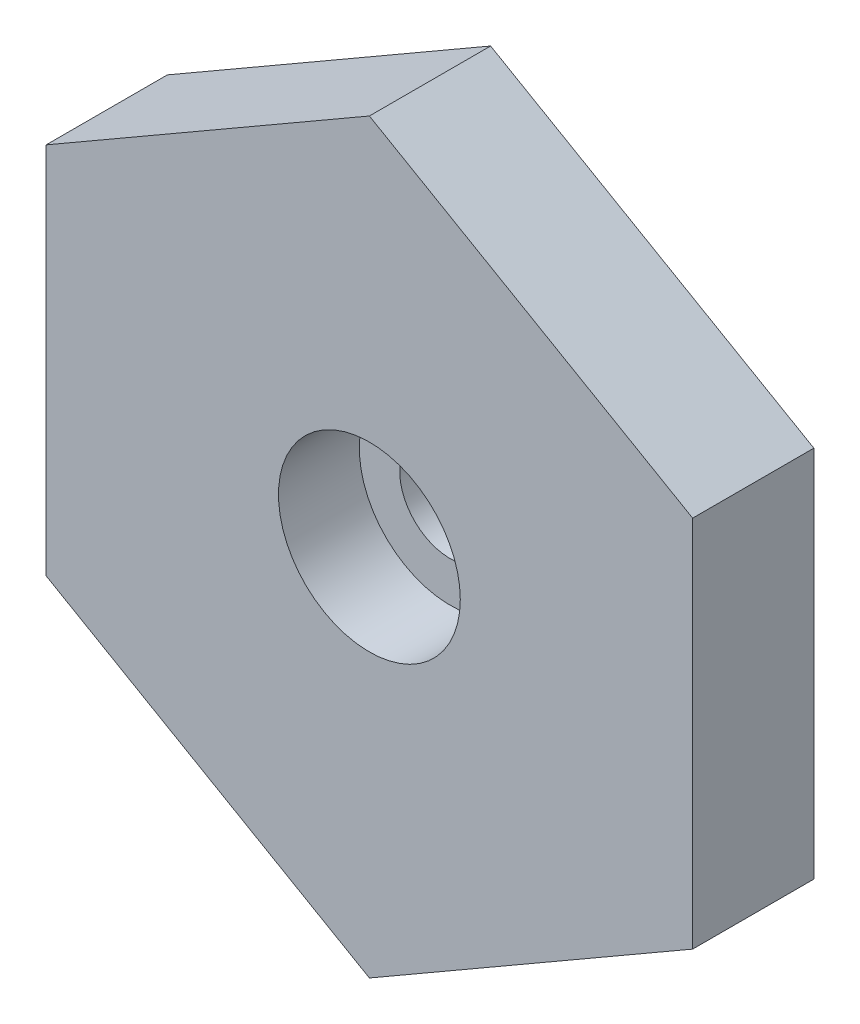
from build123d import *

# Parameters (mm, degrees)
SKIZZE1_R                       = 2.5
AUFSATZ_LINEAR_AUSTRAGEN1_DEPTH = 6
SKIZZE2_R                       = 4.5
SCHNITT_LINEAR_AUSTRAGEN1_DEPTH = 4
SKIZZE3_R                       = 8
SCHNITT_LINEAR_AUSTRAGEN2_DEPTH = 4


with BuildPart() as part:
    # Skizze1 → Aufsatz-Linear austragen1 (new body)
    with BuildSketch(Plane.XY):
        Polygon((16, 9.237604307), (0, 18.475208614), (-16, 9.237604307), (-16, -9.237604307), (0, -18.475208614), (16, -9.237604307), align=None)
        Circle(SKIZZE1_R, mode=Mode.SUBTRACT)
    extrude(amount=AUFSATZ_LINEAR_AUSTRAGEN1_DEPTH)

    # Skizze2 → Schnitt-Linear austragen1 (cut)
    with BuildSketch(Plane.XY.offset(6)):
        Circle(SKIZZE2_R)
    extrude(amount=-SCHNITT_LINEAR_AUSTRAGEN1_DEPTH, mode=Mode.SUBTRACT)

    # Skizze3 → Schnitt-Linear austragen2 (cut)
    with BuildSketch(Plane(origin=(0, 0, 0), x_dir=(-1, 0, 0), z_dir=(0, 0, -1))):
        Polygon((13.971876514, 0), (6.985938257, 12.1), (-6.985938257, 12.1), (-13.971876514, 0), (-6.985938257, -12.1), (6.985938257, -12.1), align=None)
        Circle(SKIZZE3_R, mode=Mode.SUBTRACT)
    extrude(amount=-SCHNITT_LINEAR_AUSTRAGEN2_DEPTH, mode=Mode.SUBTRACT)


solid = part.part
